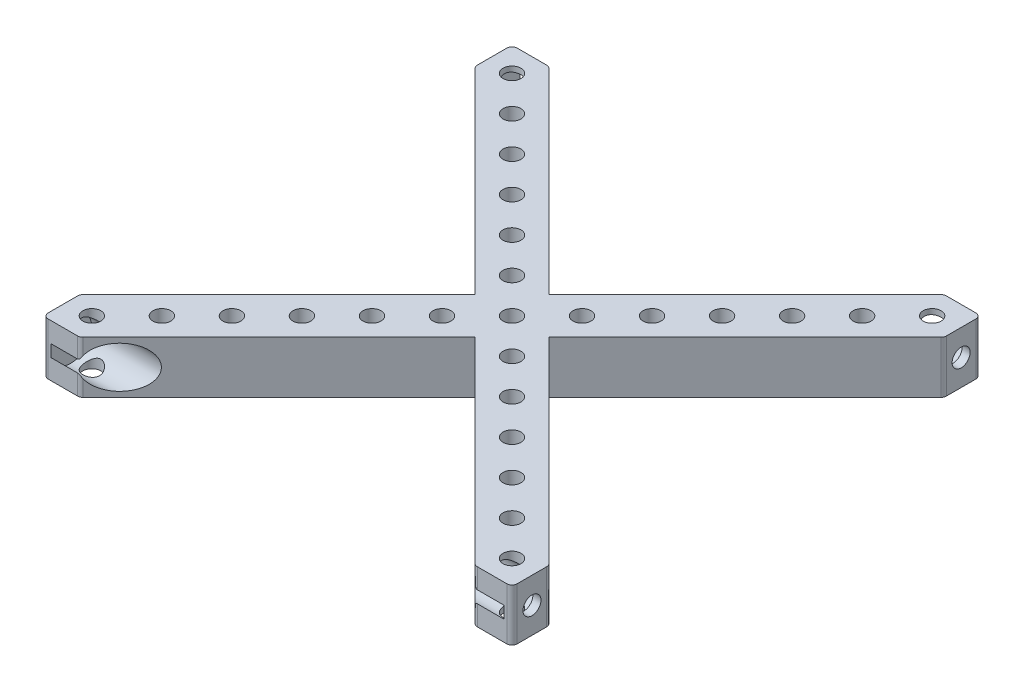
from build123d import *

# Parameters (mm, degrees)
SKETCH1_R           = 1.725
BOSS_EXTRUDE1_DEPTH = 10
FILLET1_R           = 1
SKETCH2_R           = 1.725
CUT_EXTRUDE2_DEPTH  = 1.55
SKETCH3_R           = 4
CUT_EXTRUDE3_DEPTH  = 40


with BuildPart() as part:
    # Sketch1 → Boss-Extrude1 (new body)
    # profile 1 of 5: a face of its own
    with BuildSketch(Plane(origin=(0, 0, 0), x_dir=(1, 0, 0), z_dir=(0, 1, 0))):
        Polygon((-45, 45), (-45, 37.928932188), (-7.071067812, 0), (0, 7.071067812), (-37.928932188, 45), align=None)
        with Locations(Location((-6.717514421, 6.717514421, 0), (0, 0, 270))):
            Circle(SKETCH1_R, mode=Mode.SUBTRACT)
        with Locations(Location((-13.435028843, 13.435028843, 0), (0, 0, 270))):
            Circle(SKETCH1_R, mode=Mode.SUBTRACT)
        with Locations(Location((-20.152543264, 20.152543264, 0), (0, 0, 270))):
            Circle(SKETCH1_R, mode=Mode.SUBTRACT)
        with Locations(Location((-26.870057685, 26.870057685, 0), (0, 0, 270))):
            Circle(SKETCH1_R, mode=Mode.SUBTRACT)
        with Locations(Location((-33.587572106, 33.587572106, 0), (0, 0, 270))):
            Circle(SKETCH1_R, mode=Mode.SUBTRACT)
        with Locations(Location((-40.305086528, 40.305086528, 0), (0, 0, 270))):
            Circle(SKETCH1_R, mode=Mode.SUBTRACT)
    # profile 2 of 5: a face of its own
    with BuildSketch(Plane(origin=(0, 0, 0), x_dir=(1, 0, 0), z_dir=(0, 1, 0))):
        Polygon((37.928932188, 45), (0, 7.071067812), (7.071067812, 0), (45, 37.928932188), (45, 45), align=None)
        with Locations(Location((6.717514421, 6.717514421, 0), (0, 0, 270))):
            Circle(SKETCH1_R, mode=Mode.SUBTRACT)
        with Locations(Location((13.435028843, 13.435028843, 0), (0, 0, 270))):
            Circle(SKETCH1_R, mode=Mode.SUBTRACT)
        with Locations(Location((20.152543264, 20.152543264, 0), (0, 0, 270))):
            Circle(SKETCH1_R, mode=Mode.SUBTRACT)
        with Locations(Location((26.870057685, 26.870057685, 0), (0, 0, 270))):
            Circle(SKETCH1_R, mode=Mode.SUBTRACT)
        with Locations(Location((33.587572106, 33.587572106, 0), (0, 0, 270))):
            Circle(SKETCH1_R, mode=Mode.SUBTRACT)
        with Locations(Location((40.305086528, 40.305086528, 0), (0, 0, 270))):
            Circle(SKETCH1_R, mode=Mode.SUBTRACT)
    # profile 3 of 5: a face of its own
    with BuildSketch(Plane(origin=(0, 0, 0), x_dir=(1, 0, 0), z_dir=(0, 1, 0))):
        Polygon((0, 7.071067812), (-7.071067812, 0), (0, -7.071067812), (7.071067812, 0), align=None)
        with Locations(Location((0, 0, 0), (0, 0, 270))):
            Circle(SKETCH1_R, mode=Mode.SUBTRACT)
    # profile 4 of 5: a face of its own
    with BuildSketch(Plane(origin=(0, 0, 0), x_dir=(1, 0, 0), z_dir=(0, 1, 0))):
        Polygon((7.071067812, 0), (0, -7.071067812), (37.928932188, -45), (45, -45), (45, -37.928932188), align=None)
        with Locations(Location((40.305086528, -40.305086528, 0), (0, 0, 270))):
            Circle(SKETCH1_R, mode=Mode.SUBTRACT)
        with Locations(Location((33.587572106, -33.587572106, 0), (0, 0, 270))):
            Circle(SKETCH1_R, mode=Mode.SUBTRACT)
        with Locations(Location((26.870057685, -26.870057685, 0), (0, 0, 270))):
            Circle(SKETCH1_R, mode=Mode.SUBTRACT)
        with Locations(Location((20.152543264, -20.152543264, 0), (0, 0, 270))):
            Circle(SKETCH1_R, mode=Mode.SUBTRACT)
        with Locations(Location((13.435028843, -13.435028843, 0), (0, 0, 270))):
            Circle(SKETCH1_R, mode=Mode.SUBTRACT)
        with Locations(Location((6.717514421, -6.717514421, 0), (0, 0, 270))):
            Circle(SKETCH1_R, mode=Mode.SUBTRACT)
    # profile 5 of 5: a face of its own
    with BuildSketch(Plane(origin=(0, 0, 0), x_dir=(1, 0, 0), z_dir=(0, 1, 0))):
        Polygon((0, -7.071067812), (-7.071067812, 0), (-45, -37.928932188), (-45, -45), (-37.928932188, -45), align=None)
        with Locations(Location((-40.305086528, -40.305086528, 0), (0, 0, 270))):
            Circle(SKETCH1_R, mode=Mode.SUBTRACT)
        with Locations(Location((-33.587572106, -33.587572106, 0), (0, 0, 270))):
            Circle(SKETCH1_R, mode=Mode.SUBTRACT)
        with Locations(Location((-26.870057685, -26.870057685, 0), (0, 0, 270))):
            Circle(SKETCH1_R, mode=Mode.SUBTRACT)
        with Locations(Location((-20.152543264, -20.152543264, 0), (0, 0, 270))):
            Circle(SKETCH1_R, mode=Mode.SUBTRACT)
        with Locations(Location((-13.435028843, -13.435028843, 0), (0, 0, 270))):
            Circle(SKETCH1_R, mode=Mode.SUBTRACT)
        with Locations(Location((-6.717514421, -6.717514421, 0), (0, 0, 270))):
            Circle(SKETCH1_R, mode=Mode.SUBTRACT)
    extrude(amount=BOSS_EXTRUDE1_DEPTH)

    # Fillet1
    fillet1_edges = [part.edges().sort_by_distance(p)[0] for p in [
        (-37.928932188, 5, -45),
        (37.928932188, 5, -45),
        (45, 5, -45),
        (45, 5, -37.928932188),
        (45, 5, 37.928932188),
        (45, 5, 45),
        (37.928932188, 5, 45),
        (-37.928932188, 5, 45),
        (-45, 5, 45),
        (-45, 5, 37.928932188),
        (-45, 5, -37.928932188),
        (-45, 5, -45),
    ]]
    fillet(fillet1_edges, radius=FILLET1_R)

    # Sketch2 → Cut-Extrude2 (cut)
    with BuildSketch(Plane.ZY.offset(45)):
        with Locations((-41.171572875, 5)):
            Circle(SKETCH2_R)
        with Locations((41.171572875, 5)):
            Circle(SKETCH2_R)
    cut_extrude2 = extrude(amount=-CUT_EXTRUDE2_DEPTH, mode=Mode.SUBTRACT)

    # Sketch3 → Cut-Extrude3 (cut)
    with BuildSketch(Plane.ZY.offset(43.45)):
        with Locations((-41.171572875, 5)):
            Circle(SKETCH3_R)
        with Locations((41.171572875, 5)):
            Circle(SKETCH3_R)
    cut_extrude3 = extrude(amount=-CUT_EXTRUDE3_DEPTH, mode=Mode.SUBTRACT)

    # Mirror1: Cut-Extrude2, Cut-Extrude3 across plane
    add(cut_extrude2.mirror(Plane(origin=(0, 0, 0), x_dir=(0, 0, 1), z_dir=(1, 0, 0))), mode=Mode.SUBTRACT)
    add(cut_extrude3.mirror(Plane(origin=(0, 0, 0), x_dir=(0, 0, 1), z_dir=(1, 0, 0))), mode=Mode.SUBTRACT)


solid = part.part
